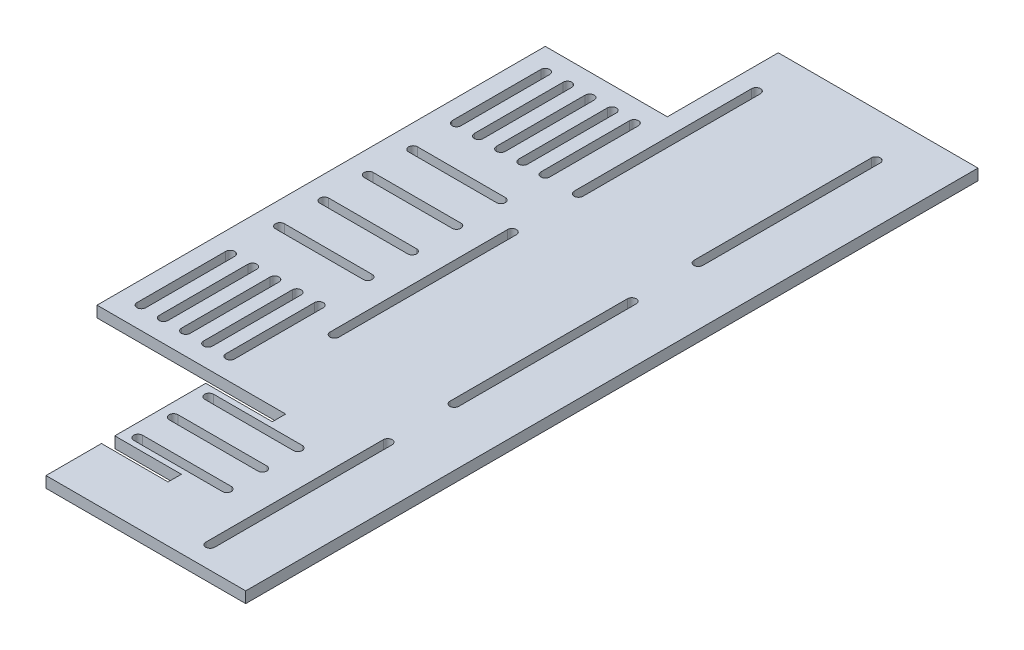
from build123d import *

# Parameters (mm, degrees)
BOSS_EXTRUDE1_DEPTH = 5
SKETCH2_W           = 55
SKETCH2_H           = 50
CUT_EXTRUDE1_DEPTH  = 273.349040755
CUT_EXTRUDE2_DEPTH  = 273.349040755
SKETCH4_W           = 30
SKETCH4_H           = 1
CUT_EXTRUDE3_DEPTH  = 273.349040755
CUT_EXTRUDE4_DEPTH  = 273.349040755
CUT_EXTRUDE5_DEPTH  = 273.349040755
CUT_EXTRUDE6_DEPTH  = 273.349040755


with BuildPart() as part:
    # Sketch1 → Boss-Extrude1 (new body)
    with BuildSketch(Plane(origin=(0, 0, 0), x_dir=(1, 0, 0), z_dir=(0, 1, 0))):
        Polygon((0, 0), (0, -43), (30, -43), (30, -48), (0, -48), (0, -73), (90, -73), (90, 257), (-55, 257), (-55, 5), (0, 5), (30, 5), (30, 0), align=None)
    extrude(amount=BOSS_EXTRUDE1_DEPTH)

    # Sketch2 → Cut-Extrude1 (cut, through all)
    with BuildSketch(Plane(origin=(0, 5, 0), x_dir=(1, 0, 0), z_dir=(0, 1, 0))):
        with Locations((-27.5, 232)):
            Rectangle(SKETCH2_W, SKETCH2_H)
    extrude(amount=-CUT_EXTRUDE1_DEPTH, mode=Mode.SUBTRACT)

    # Sketch3 → Cut-Extrude2 (cut, through all)
    with BuildSketch(Plane(origin=(0, 5, 0), x_dir=(1, 0, 0), z_dir=(0, 1, 0))):
        with BuildLine():
            Line((66, 237), (66, 157))
            ThreePointArc((66, 157), (64, 155), (62, 157))
            Line((62, 157), (62, 237))
            ThreePointArc((62, 237), (64, 239), (66, 237))
        make_face()
        with BuildLine():
            Line((66, 127), (66, 47))
            ThreePointArc((66, 47), (64, 45), (62, 47))
            Line((62, 47), (62, 127))
            ThreePointArc((62, 127), (64, 129), (66, 127))
        make_face()
        with BuildLine():
            Line((66, 17), (66, -63))
            ThreePointArc((66, -63), (64, -65), (62, -63))
            Line((62, -63), (62, 17))
            ThreePointArc((62, 17), (64, 19), (66, 17))
        make_face()
        with BuildLine():
            Line((8, 237), (8, 157))
            ThreePointArc((8, 157), (10, 155), (12, 157))
            Line((12, 157), (12, 237))
            ThreePointArc((12, 237), (10, 239), (8, 237))
        make_face()
        with BuildLine():
            Line((8, 127), (8, 47))
            ThreePointArc((8, 47), (10, 45), (12, 47))
            Line((12, 47), (12, 127))
            ThreePointArc((12, 127), (10, 129), (8, 127))
        make_face()
    extrude(amount=-CUT_EXTRUDE2_DEPTH, mode=Mode.SUBTRACT)

    # Sketch4 → Cut-Extrude3 (cut, through all)
    with BuildSketch(Plane(origin=(0, 5, 0), x_dir=(1, 0, 0), z_dir=(0, 1, 0))):
        with Locations((15, -0.5)):
            Rectangle(SKETCH4_W, SKETCH4_H)
        with Locations((15, -42.5)):
            Rectangle(SKETCH4_W, SKETCH4_H)
    extrude(amount=-CUT_EXTRUDE3_DEPTH, mode=Mode.SUBTRACT)

    # Sketch5 → Cut-Extrude4 (cut, through all)
    with BuildSketch(Plane(origin=(0, 5, 0), x_dir=(1, 0, 0), z_dir=(0, 1, 0))):
        with BuildLine():
            Line((6, -19.5), (46, -19.5))
            ThreePointArc((46, -19.5), (48, -21.5), (46, -23.5))
            Line((46, -23.5), (6, -23.5))
            ThreePointArc((6, -23.5), (4, -21.5), (6, -19.5))
        make_face()
        with BuildLine():
            Line((6, -3.5), (46, -3.5))
            ThreePointArc((46, -3.5), (48, -5.5), (46, -7.5))
            Line((46, -7.5), (6, -7.5))
            ThreePointArc((6, -7.5), (4, -5.5), (6, -3.5))
        make_face()
        with BuildLine():
            Line((6, -35.5), (46, -35.5))
            ThreePointArc((46, -35.5), (48, -37.5), (46, -39.5))
            Line((46, -39.5), (6, -39.5))
            ThreePointArc((6, -39.5), (4, -37.5), (6, -35.5))
        make_face()
    extrude(amount=-CUT_EXTRUDE4_DEPTH, mode=Mode.SUBTRACT)

    # Sketch6 → Cut-Extrude5 (cut, through all)
    with BuildSketch(Plane(origin=(0, 5, 0), x_dir=(1, 0, 0), z_dir=(0, 1, 0))):
        with BuildLine():
            Line((-43, 197), (-43, 157))
            ThreePointArc((-43, 157), (-45, 155), (-47, 157))
            Line((-47, 157), (-47, 197))
            ThreePointArc((-47, 197), (-45, 199), (-43, 197))
        make_face()
        with BuildLine():
            Line((-33, 197), (-33, 157))
            ThreePointArc((-33, 157), (-35, 155), (-37, 157))
            Line((-37, 157), (-37, 197))
            ThreePointArc((-37, 197), (-35, 199), (-33, 197))
        make_face()
        with BuildLine():
            Line((-23, 197), (-23, 157))
            ThreePointArc((-23, 157), (-25, 155), (-27, 157))
            Line((-27, 157), (-27, 197))
            ThreePointArc((-27, 197), (-25, 199), (-23, 197))
        make_face()
        with BuildLine():
            Line((-13, 197), (-13, 157))
            ThreePointArc((-13, 157), (-15, 155), (-17, 157))
            Line((-17, 157), (-17, 197))
            ThreePointArc((-17, 197), (-15, 199), (-13, 197))
        make_face()
        with BuildLine():
            Line((-3, 197), (-3, 157))
            ThreePointArc((-3, 157), (-5, 155), (-7, 157))
            Line((-7, 157), (-7, 197))
            ThreePointArc((-7, 197), (-5, 199), (-3, 197))
        make_face()
        with BuildLine():
            Line((-43, 15), (-43, 55))
            ThreePointArc((-43, 55), (-45, 57), (-47, 55))
            Line((-47, 55), (-47, 15))
            ThreePointArc((-47, 15), (-45, 13), (-43, 15))
        make_face()
        with BuildLine():
            Line((-33, 15), (-33, 55))
            ThreePointArc((-33, 55), (-35, 57), (-37, 55))
            Line((-37, 55), (-37, 15))
            ThreePointArc((-37, 15), (-35, 13), (-33, 15))
        make_face()
        with BuildLine():
            Line((-23, 15), (-23, 55))
            ThreePointArc((-23, 55), (-25, 57), (-27, 55))
            Line((-27, 55), (-27, 15))
            ThreePointArc((-27, 15), (-25, 13), (-23, 15))
        make_face()
        with BuildLine():
            Line((-13, 15), (-13, 55))
            ThreePointArc((-13, 55), (-15, 57), (-17, 55))
            Line((-17, 55), (-17, 15))
            ThreePointArc((-17, 15), (-15, 13), (-13, 15))
        make_face()
        with BuildLine():
            Line((-3, 15), (-3, 55))
            ThreePointArc((-3, 55), (-5, 57), (-7, 55))
            Line((-7, 55), (-7, 15))
            ThreePointArc((-7, 15), (-5, 13), (-3, 15))
        make_face()
    extrude(amount=-CUT_EXTRUDE5_DEPTH, mode=Mode.SUBTRACT)

    # Sketch7 → Cut-Extrude6 (cut, through all)
    with BuildSketch(Plane(origin=(0, 5, 0), x_dir=(1, 0, 0), z_dir=(0, 1, 0))):
        with BuildLine():
            Line((-44.604932944, 139), (-5, 139))
            ThreePointArc((-5, 139), (-3, 137), (-5, 135))
            Line((-5, 135), (-44.604932944, 135))
            ThreePointArc((-44.604932944, 135), (-46.604932944, 137), (-44.604932944, 139))
        make_face()
        with BuildLine():
            Line((-44.604932944, 119), (-5, 119))
            ThreePointArc((-5, 119), (-3, 117), (-5, 115))
            Line((-5, 115), (-44.604932944, 115))
            ThreePointArc((-44.604932944, 115), (-46.604932944, 117), (-44.604932944, 119))
        make_face()
        with BuildLine():
            Line((-44.604932944, 99), (-5, 99))
            ThreePointArc((-5, 99), (-3, 97), (-5, 95))
            Line((-5, 95), (-44.604932944, 95))
            ThreePointArc((-44.604932944, 95), (-46.604932944, 97), (-44.604932944, 99))
        make_face()
        with BuildLine():
            Line((-44.604932944, 79), (-5, 79))
            ThreePointArc((-5, 79), (-3, 77), (-5, 75))
            Line((-5, 75), (-44.604932944, 75))
            ThreePointArc((-44.604932944, 75), (-46.604932944, 77), (-44.604932944, 79))
        make_face()
    extrude(amount=-CUT_EXTRUDE6_DEPTH, mode=Mode.SUBTRACT)


solid = part.part
